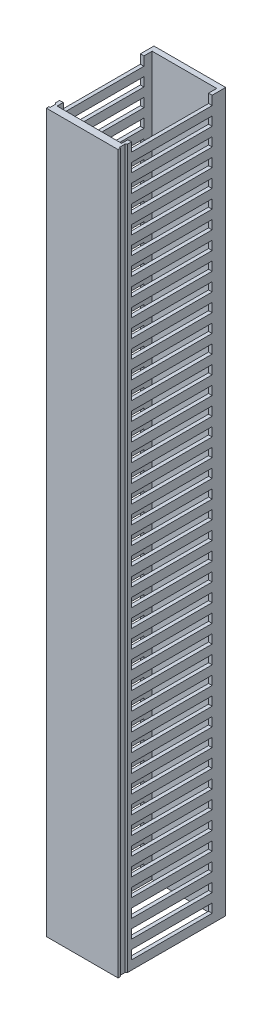
from build123d import *

# Parameters (mm, degrees)
SKETCH1_W           = 40
SKETCH1_H           = 60
BOSS_EXTRUDE1_DEPTH = 400
CUT_EXTRUDE1_DEPTH  = 407.448028658
SKETCH3_W           = 45
SKETCH3_H           = 5
CUT_EXTRUDE2_DEPTH  = 407.448028658
SKETCH4_W           = 36
SKETCH4_H           = 53
CUT_EXTRUDE3_DEPTH  = 407.448028658
LPATTERN1_COUNT     = 40
LPATTERN1_PITCH     = 10


with BuildPart() as part:
    # Sketch1 → Boss-Extrude1 (new body)
    with BuildSketch(Plane(origin=(0, 0, 0), x_dir=(1, 0, 0), z_dir=(0, 1, 0))):
        with Locations((20, 30)):
            Rectangle(SKETCH1_W, SKETCH1_H)
    extrude(amount=BOSS_EXTRUDE1_DEPTH)

    # Sketch2 → Cut-Extrude1 (cut, through all)
    with BuildSketch(Plane.XZ):
        Polygon((-1.684108549, -1.456175345), (0.697832705, -1.456175345), (0.697832705, -4.5643182), (-2.032685317, -6.77197107), align=None)
        Polygon((42.032685317, -6.77197107), (41.684108549, -1.456175345), (39.302167295, -1.456175345), (39.302167295, -4.5643182), align=None)
    extrude(amount=-CUT_EXTRUDE1_DEPTH, mode=Mode.SUBTRACT)

    # Sketch3 → Cut-Extrude2 (cut, through all)
    with BuildSketch(Plane.ZY):
        with Locations((-29.946321538, 7.5)):
            Rectangle(SKETCH3_W, SKETCH3_H)
    cut_extrude2 = extrude(amount=-CUT_EXTRUDE2_DEPTH, mode=Mode.SUBTRACT)

    # Sketch4 → Cut-Extrude3 (cut, through all)
    with BuildSketch(Plane(origin=(0, 400, 0), x_dir=(1, 0, 0), z_dir=(0, 1, 0))):
        with Locations((20, 30.5)):
            Rectangle(SKETCH4_W, SKETCH4_H)
    extrude(amount=-CUT_EXTRUDE3_DEPTH, mode=Mode.SUBTRACT)

    # LPattern1: Cut-Extrude2 ×40
    with Locations(*[(0, i * LPATTERN1_PITCH, 0) for i in range(1, LPATTERN1_COUNT)]):
        add(cut_extrude2, mode=Mode.SUBTRACT)


solid = part.part
